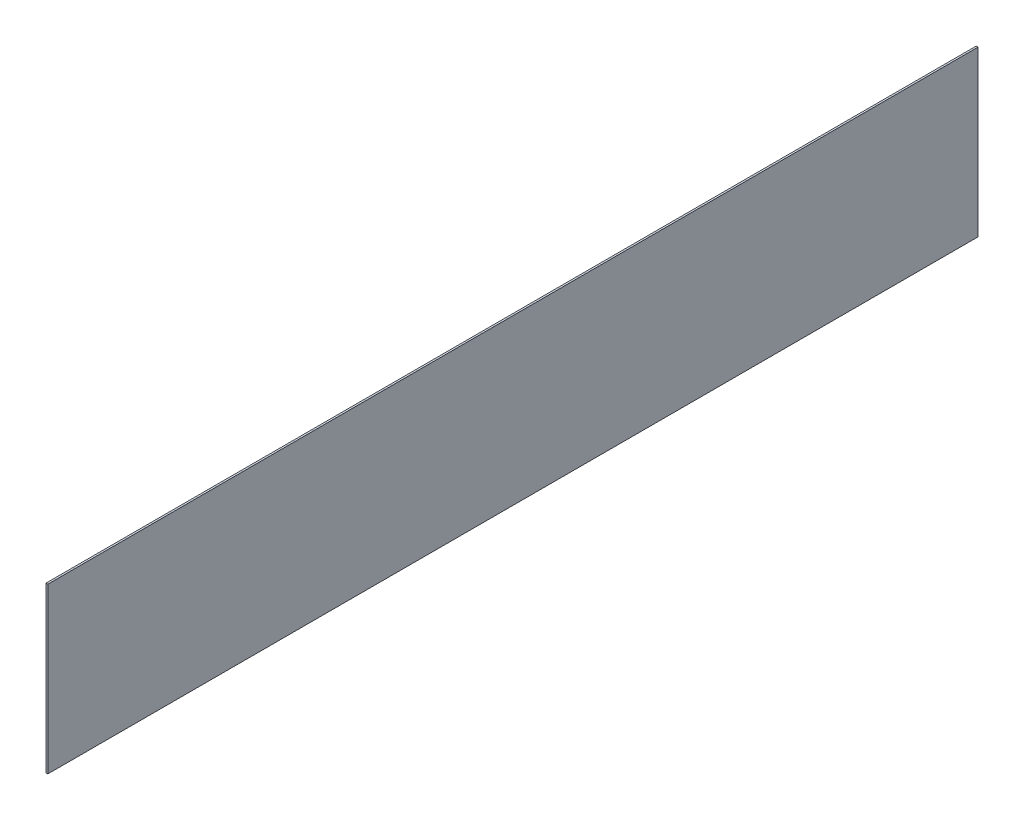
from build123d import *

# Parameters (mm, degrees)
SKETCH_1_W      = 12
SKETCH_1_H      = 1060
EXTRUDE_1_DEPTH = 3000


with BuildPart() as part:
    # 草图1 → 凸台-拉伸1 (new, symmetric)
    with BuildSketch(Plane.XY):
        Rectangle(SKETCH_1_W, SKETCH_1_H)
    extrude(amount=EXTRUDE_1_DEPTH, both=True)


solid = part.part
